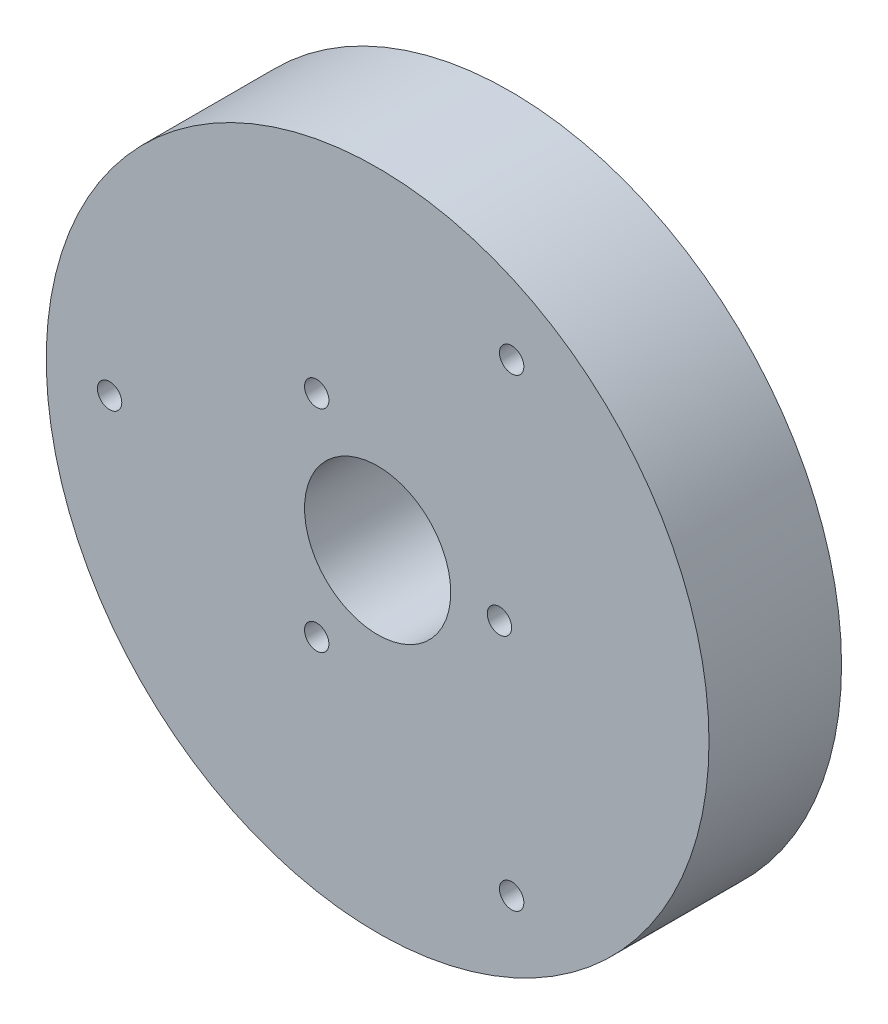
from build123d import *

# Parameters (mm, degrees)
SKETCH_1_R          = 34
EXTRUDE_1_DEPTH     = 13.6
SKETCH_2_R          = 16.5
EXTRUDE_2_DEPTH     = 8.9
FILLET_1_R          = 1
SKETCH_3_R          = 4
CUT_EXTRUDE_1_DEPTH = 54.087192429
SKETCH_4_R          = 7.5
CUT_EXTRUDE_2_DEPTH = 54.087192429
M3X0_52_D           = 2.5
M3X0_53_D           = 2.5
SKETCH_15_R         = 20.204336051
CUT_EXTRUDE_3_DEPTH = 8.9


with BuildPart() as part:
    # Эскиз1 → Бобышка-Вытянуть1 (new body)
    with BuildSketch(Plane.XY):
        Circle(SKETCH_1_R)
    extrude(amount=EXTRUDE_1_DEPTH)

    # Эскиз2 → Бобышка-Вытянуть2 (add)
    with BuildSketch(Plane.XY.offset(13.6)):
        Circle(SKETCH_2_R)
    extrude(amount=EXTRUDE_2_DEPTH)

    # Скругление1
    fillet_1_edges = [part.edges().sort_by_distance(p)[0] for p in [
        (-16.5, 0, 22.5),
    ]]
    fillet(fillet_1_edges, radius=FILLET_1_R)

    # Эскиз3 → Вырез-Вытянуть1 (cut, through all)
    with BuildSketch(Plane(origin=(0, 0, 0), x_dir=(-1, 0, 0), z_dir=(0, 0, -1))):
        Circle(SKETCH_3_R)
    extrude(amount=-CUT_EXTRUDE_1_DEPTH, mode=Mode.SUBTRACT)

    # Эскиз4 → Вырез-Вытянуть2 (cut, through all)
    with BuildSketch(Plane.XY.offset(22.5)):
        Circle(SKETCH_4_R)
    extrude(amount=-CUT_EXTRUDE_2_DEPTH, mode=Mode.SUBTRACT)

    # Отверстие обработанное метчиком M3x0.52 (through all)
    with Locations(Plane(origin=(5.176865527, -11.054831177, 0), x_dir=(1, 0, 0), z_dir=(0, 0, -1))):
        with Locations((-11.426865527, -21.880148725), (-11.426865527, -0.22951363), (7.323134473, -11.054831177)):
            Hole(M3X0_52_D / 2)

    # Отверстие обработанное метчиком M3x0.53 (through all)
    with Locations(Plane(origin=(7.745995854, 28.191062488, 0), x_dir=(1, 0, 0), z_dir=(0, 0, -1))):
        with Locations((6.004004146, 4.375363884), (-35.245995854, 28.191062488), (6.004004146, 52.006761092)):
            Hole(M3X0_53_D / 2)

    # Эскиз15 → Вырез-Вытянуть3 (cut)
    with BuildSketch(Plane.XY.offset(22.5)):
        Circle(SKETCH_15_R)
    extrude(amount=-CUT_EXTRUDE_3_DEPTH, mode=Mode.SUBTRACT)


solid = part.part
